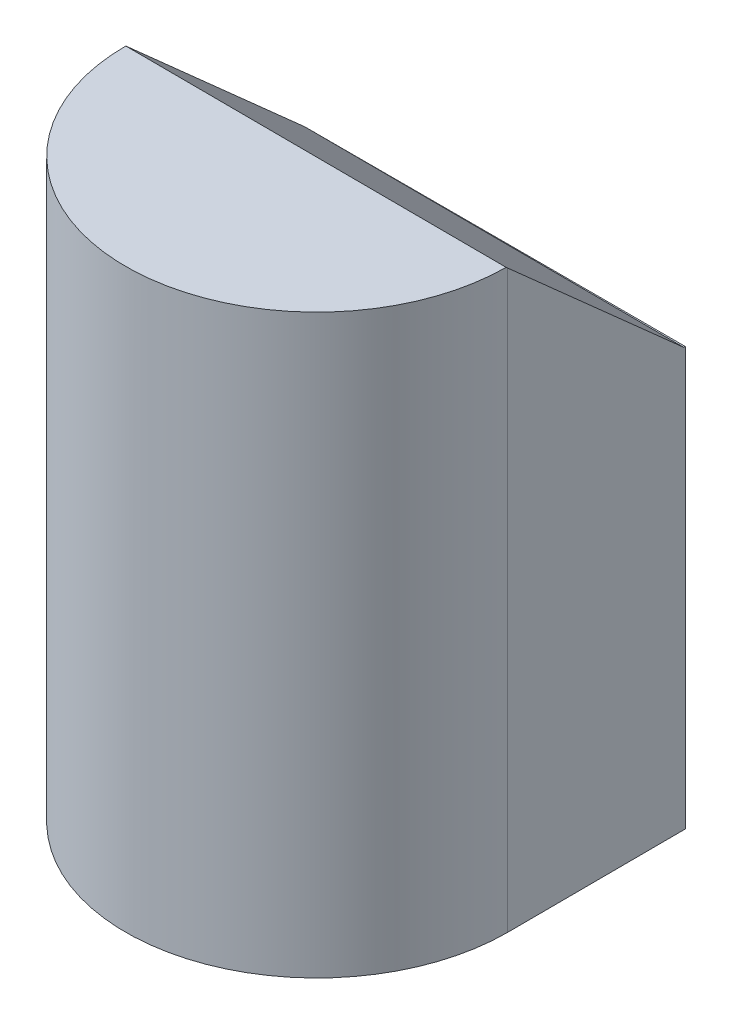
from build123d import *

# Parameters (mm, degrees)
BOSS_EXTRUDE1_DEPTH = 164.30625
CUT_EXTRUDE1_DEPTH  = 205.500810654
CUT_EXTRUDE2_DEPTH  = 205.500810654


with BuildPart() as part:
    # Sketch3 → Boss-Extrude1 (new body)
    with BuildSketch(Plane(origin=(0, 0, 0), x_dir=(1, 0, 0), z_dir=(0, 1, 0))):
        with BuildLine():
            Line((-54.2036, 50.8), (-54.4068, 0))
            ThreePointArc((-54.4068, 0), (0, -54.4068), (54.4068, 0))
            Line((54.4068, 0), (54.2036, 50.8))
            Line((54.2036, 50.8), (-54.2036, 50.8))
        make_face()
    extrude(amount=BOSS_EXTRUDE1_DEPTH)

    # Sketch6 → Cut-Extrude1 (cut, through all)
    with BuildSketch(Plane(origin=(-54.405929505, 0, -0.217623718), x_dir=(-0.003999968000384008, 0, 0.9999920000959988), z_dir=(-0.9999920000959988, 0, -0.003999968000384008))):
        Polygon((-50.582780939, 119.0752), (0.217625459, 164.30625), (-50.582780939, 164.30625), align=None)
    extrude(amount=-CUT_EXTRUDE1_DEPTH, mode=Mode.SUBTRACT)

    # Sketch6<3> → Cut-Extrude2 (cut, through all)
    with BuildSketch(Plane(origin=(-54.405929505, 0, -0.217623718), x_dir=(-0.003999968000384008, 0, 0.9999920000959988), z_dir=(-0.9999920000959988, 0, -0.003999968000384008))):
        Polygon((-50.582780939, 119.0752), (0.217625459, 164.30625), (0.217625459, 170.743194309), (-79.741095166, 170.743194309), (-79.741095166, 119.0752), align=None)
    extrude(amount=-CUT_EXTRUDE2_DEPTH, mode=Mode.SUBTRACT)


solid = part.part
